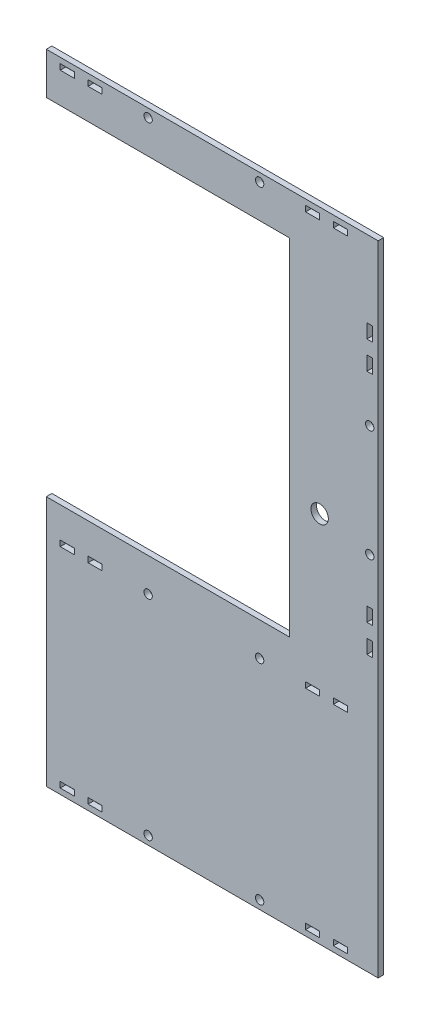
from build123d import *

# Parameters (mm, degrees)
SKETCH_1_R      = 1.5
SKETCH_1_R_2    = 3.121318996
SKETCH_1_W      = 5.05
SKETCH_1_H      = 2.05
SKETCH_1_W_2    = 2.05
SKETCH_1_H_2    = 5.05
EXTRUDE_1_DEPTH = 2


with BuildPart() as part:
    # 草图1 → 凸台-拉伸1 (new body)
    with BuildSketch(Plane.XY):
        Polygon((-56.111334712, -13.372248853), (31.071025228, -13.372248853), (31.071025228, -137.372248853), (-56.111334712, -137.372248853), (-56.111334712, -152.372248853), (-56.111334712, -227.397248853), (62.919821756, -227.397248853), (62.919821756, -152.372248853), (62.919821756, 1.627751147), (-56.111334712, 1.627751147), align=None)
        with Locations((-19.586334712, -1.372248853)):
            Circle(SKETCH_1_R, mode=Mode.SUBTRACT)
        with Locations((20.413665288, -1.372248853)):
            Circle(SKETCH_1_R, mode=Mode.SUBTRACT)
        with Locations((-19.586334712, -149.372248853)):
            Circle(SKETCH_1_R, mode=Mode.SUBTRACT)
        with Locations((20.413665288, -149.372248853)):
            Circle(SKETCH_1_R, mode=Mode.SUBTRACT)
        with Locations((59.919821756, -97.372248853)):
            Circle(SKETCH_1_R, mode=Mode.SUBTRACT)
        with Locations((59.919821756, -57.372248853)):
            Circle(SKETCH_1_R, mode=Mode.SUBTRACT)
        with Locations((41.938665288, -93.678088908)):
            Circle(SKETCH_1_R_2, mode=Mode.SUBTRACT)
        with Locations((-19.586334712, -224.372248853)):
            Circle(SKETCH_1_R, mode=Mode.SUBTRACT)
        with Locations((20.413665288, -224.372248853)):
            Circle(SKETCH_1_R, mode=Mode.SUBTRACT)
        with Locations((39.413665288, -1.372248853)):
            Rectangle(SKETCH_1_W, SKETCH_1_H, mode=Mode.SUBTRACT)
        with Locations((49.413665288, -1.372248853)):
            Rectangle(SKETCH_1_W, SKETCH_1_H, mode=Mode.SUBTRACT)
        with Locations((-48.586334712, -1.372248853)):
            Rectangle(SKETCH_1_W, SKETCH_1_H, mode=Mode.SUBTRACT)
        with Locations((-38.586334712, -1.372248853)):
            Rectangle(SKETCH_1_W, SKETCH_1_H, mode=Mode.SUBTRACT)
        with Locations((39.413665288, -149.372248853)):
            Rectangle(SKETCH_1_W, SKETCH_1_H, mode=Mode.SUBTRACT)
        with Locations((49.413665288, -149.372248853)):
            Rectangle(SKETCH_1_W, SKETCH_1_H, mode=Mode.SUBTRACT)
        with Locations((-48.586334712, -149.372248853)):
            Rectangle(SKETCH_1_W, SKETCH_1_H, mode=Mode.SUBTRACT)
        with Locations((-38.586334712, -149.372248853)):
            Rectangle(SKETCH_1_W, SKETCH_1_H, mode=Mode.SUBTRACT)
        with Locations((59.919821756, -38.372248853)):
            Rectangle(SKETCH_1_W_2, SKETCH_1_H_2, mode=Mode.SUBTRACT)
        with Locations((59.919821756, -28.372248853)):
            Rectangle(SKETCH_1_W_2, SKETCH_1_H_2, mode=Mode.SUBTRACT)
        with Locations((59.919821756, -126.372248853)):
            Rectangle(SKETCH_1_W_2, SKETCH_1_H_2, mode=Mode.SUBTRACT)
        with Locations((59.919821756, -116.372248853)):
            Rectangle(SKETCH_1_W_2, SKETCH_1_H_2, mode=Mode.SUBTRACT)
        with Locations((39.413665288, -224.372248853)):
            Rectangle(SKETCH_1_W, SKETCH_1_H, mode=Mode.SUBTRACT)
        with Locations((49.413665288, -224.372248853)):
            Rectangle(SKETCH_1_W, SKETCH_1_H, mode=Mode.SUBTRACT)
        with Locations((-48.586334712, -224.372248853)):
            Rectangle(SKETCH_1_W, SKETCH_1_H, mode=Mode.SUBTRACT)
        with Locations((-38.586334712, -224.372248853)):
            Rectangle(SKETCH_1_W, SKETCH_1_H, mode=Mode.SUBTRACT)
    extrude(amount=EXTRUDE_1_DEPTH)


solid = part.part
